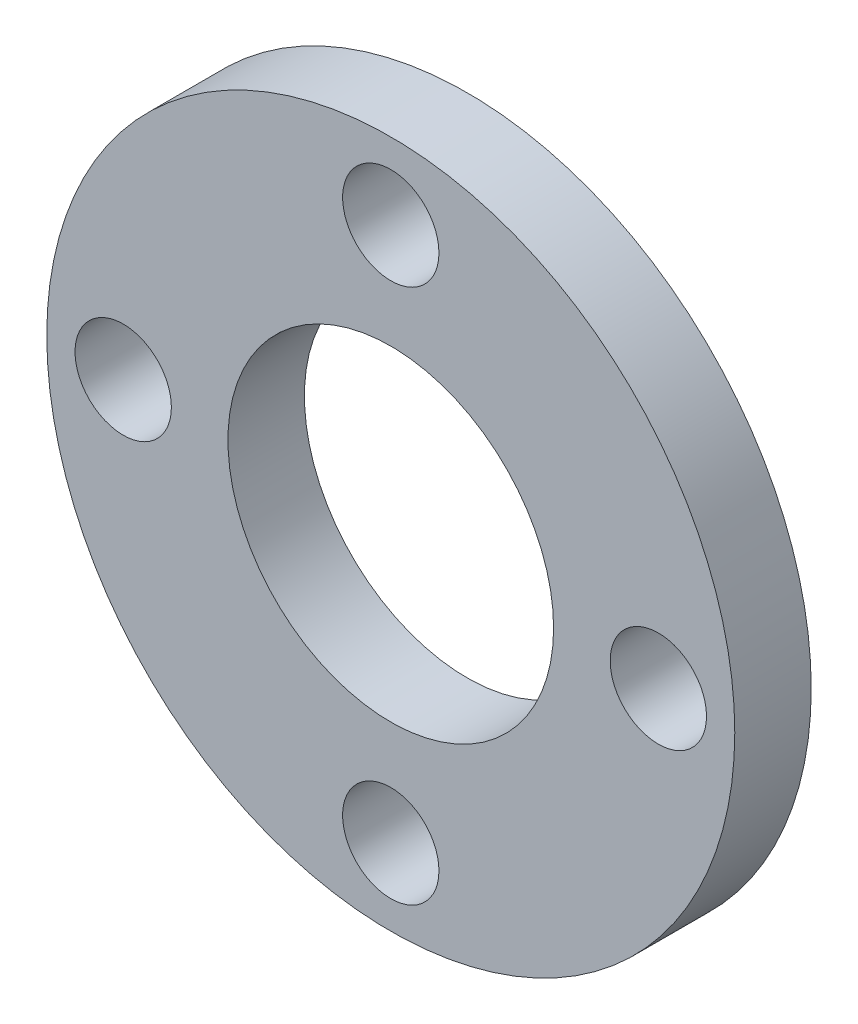
from build123d import *

# Parameters (mm, degrees)
SZKIC1_R                    = 45
SZKIC1_R_2                  = 6.3
SZKIC1_R_3                  = 21.3
DODANIE_WYCI_GNI_CIE3_DEPTH = 10


with BuildPart() as part:
    # Szkic1 → Dodanie-wyciągnięcie3 (new body)
    with BuildSketch(Plane.XY):
        Circle(SZKIC1_R)
        with Locations((0, 35)):
            Circle(SZKIC1_R_2, mode=Mode.SUBTRACT)
        with Locations((35, 0)):
            Circle(SZKIC1_R_2, mode=Mode.SUBTRACT)
        with Locations((0, -35)):
            Circle(SZKIC1_R_2, mode=Mode.SUBTRACT)
        with Locations((-35, 0)):
            Circle(SZKIC1_R_2, mode=Mode.SUBTRACT)
        Circle(SZKIC1_R_3, mode=Mode.SUBTRACT)
    extrude(amount=DODANIE_WYCI_GNI_CIE3_DEPTH)


solid = part.part
